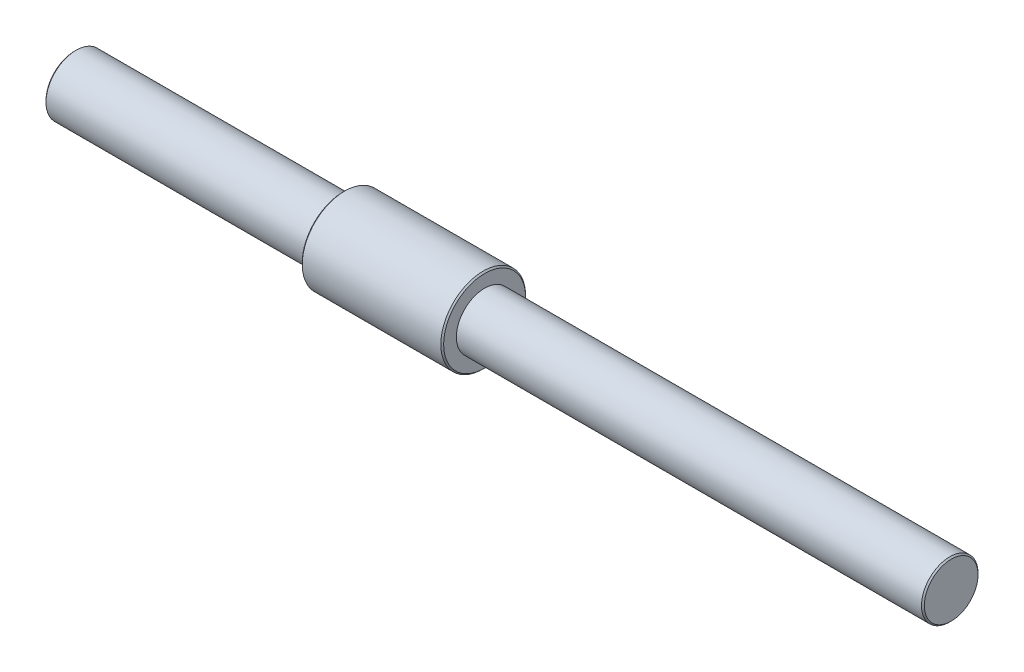
from build123d import *

# Parameters (mm, degrees)
CHAMFER1_SIZE = 0.1
CHAMFER3_SIZE = 0.1
CHAMFER4_SIZE = 0.1
CHAMFER5_SIZE = 0.1


with BuildPart() as part:
    # Sketch1 → Revolve1 (revolve)
    with BuildSketch(Plane.XY, mode=Mode.PRIVATE) as revolve1_sk:
        Polygon((0, 0), (29, 0), (62, 0), (62, 2), (29, 2), (29, 3), (19, 3), (19, 2.125), (0, 2.125), align=None)
    revolve(revolve1_sk.sketch.rotate(Axis((0, 0, 0), (1, 0, 0)), 90), axis=Axis((0, 0, 0), (1, 0, 0)))

    # Chamfer1
    chamfer1_edges = [part.edges().sort_by_distance(p)[0] for p in [
        (0, 0, -2.125),
    ]]
    chamfer(chamfer1_edges, length=CHAMFER1_SIZE)

    # Chamfer3
    chamfer3_edges = [part.edges().sort_by_distance(p)[0] for p in [
        (29, 0, -3),
    ]]
    chamfer(chamfer3_edges, length=CHAMFER3_SIZE)

    # Chamfer4
    chamfer4_edges = [part.edges().sort_by_distance(p)[0] for p in [
        (62, 0, -2),
    ]]
    chamfer(chamfer4_edges, length=CHAMFER4_SIZE)

    # Chamfer5
    chamfer5_edges = [part.edges().sort_by_distance(p)[0] for p in [
        (19, 0, -3),
    ]]
    chamfer(chamfer5_edges, length=CHAMFER5_SIZE)


solid = part.part
